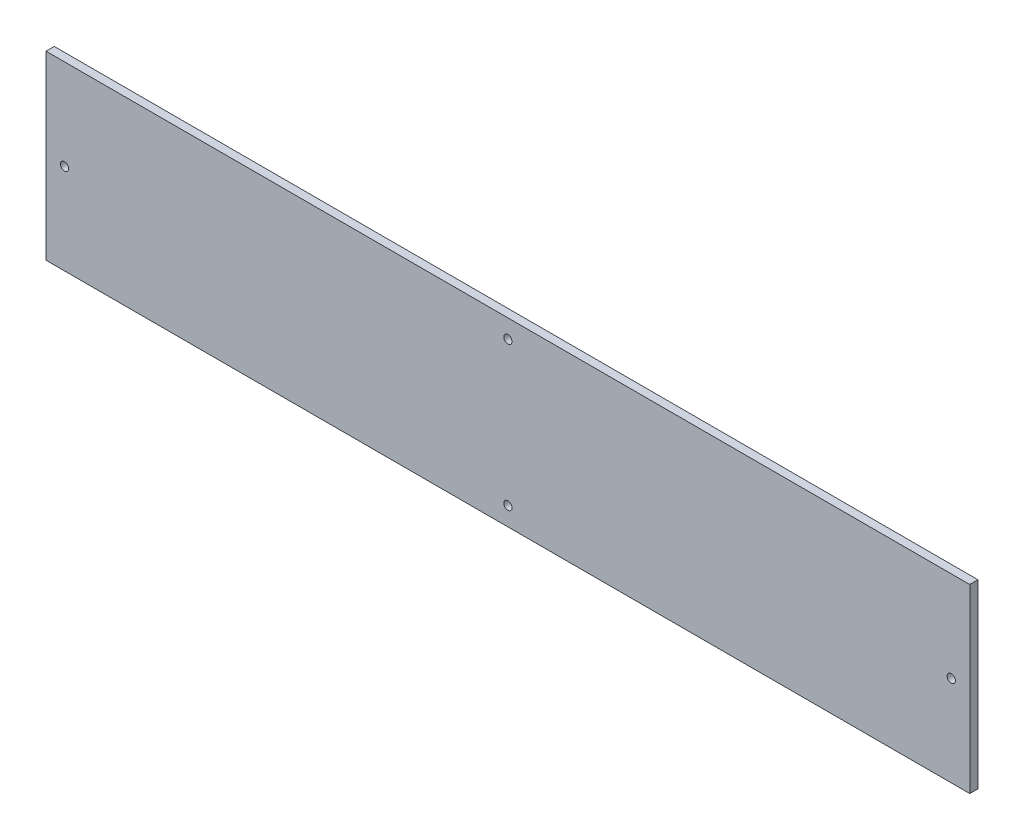
from build123d import *

# Parameters (mm, degrees)
SCHIZZO1_W                   = 449
SCHIZZO1_H                   = 88
SCHIZZO1_R                   = 2
ESTRUSIONE_ESTRUSIONE1_DEPTH = 4


with BuildPart() as part:
    # Schizzo1 → Estrusione-Estrusione1 (new body)
    with BuildSketch(Plane.XY):
        with Locations((-224.5, 44)):
            Rectangle(SCHIZZO1_W, SCHIZZO1_H)
        with Locations((-9, 44)):
            Circle(SCHIZZO1_R, mode=Mode.SUBTRACT)
        with Locations((-224.5, 79)):
            Circle(SCHIZZO1_R, mode=Mode.SUBTRACT)
        with Locations(Location((-440, 44, 0), (0, 0, 180))):
            Circle(SCHIZZO1_R, mode=Mode.SUBTRACT)
        with Locations(Location((-224.5, 9, 0), (0, 0, 180))):
            Circle(SCHIZZO1_R, mode=Mode.SUBTRACT)
    extrude(amount=ESTRUSIONE_ESTRUSIONE1_DEPTH)


solid = part.part
